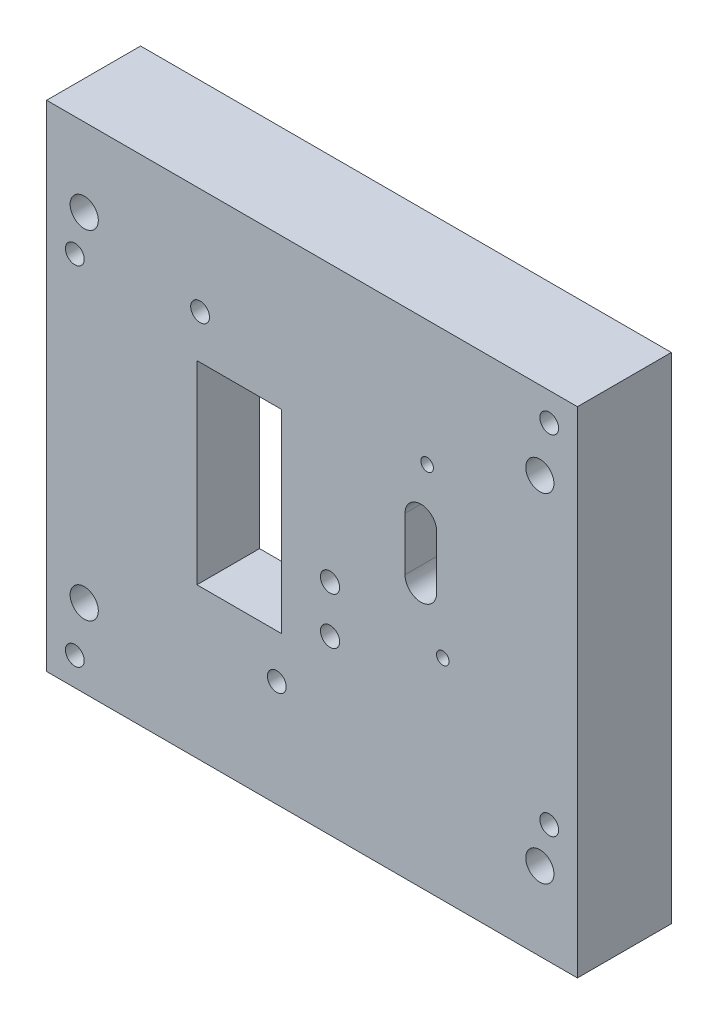
from build123d import *

# Parameters (mm, degrees)
SKETCH2_W                       = 169.5
SKETCH2_H                       = 158
BOSS_EXTRUDE1_DEPTH             = 30
CUT_EXTRUDE2_START              = -10
SKETCH4_R                       = 3.06
SKETCH4_W                       = 27
SKETCH4_H                       = 62
CUT_EXTRUDE2_DEPTH              = 137.360001366
CUT_EXTRUDE4_DEPTH              = 10
SKETCH9_R                       = 2
CUT_EXTRUDE14_DEPTH             = 15
SKETCH11_R                      = 3
CUT_EXTRUDE16_DEPTH             = 7.5
CBORE_FOR_M8_SHCS1_D            = 9
CBORE_FOR_M8_SHCS1_CBORE_D      = 15
CBORE_FOR_M8_SHCS1_CBORE_DEPTH  = 8
M8X1_25_TAPPED_HOLE1_D          = 6.8
M8X1_25_TAPPED_HOLE1_DEPTH      = 12
M8X1_25_TAPPED_HOLE1_TIP        = 2.042926105
M6X1_0_TAPPED_HOLE1_D           = 5
M6X1_0_TAPPED_HOLE1_DEPTH       = 12
M6X1_0_TAPPED_HOLE1_TIP         = 1.502151548
M6X1_0_TAPPED_HOLE2_D           = 5
M6X1_0_TAPPED_HOLE2_DEPTH       = 12
M6X1_0_TAPPED_HOLE2_TIP         = 1.502151548
M6X1_0_TAPPED_HOLE3_D           = 5
M6X1_0_TAPPED_HOLE3_DEPTH       = 12
M6X1_0_TAPPED_HOLE3_CBORE_D     = 6
M6X1_0_TAPPED_HOLE3_CBORE_DEPTH = 6.5
M6X1_0_TAPPED_HOLE3_TIP         = 1.502151548
F_6_0MM_CLEARANCE_DOWEL_HOLE1_D = 6
F_6_0MM_CLEARANCE_DOWEL_HOLE2_D = 6
F_6_0MM_CLEARANCE_DOWEL_HOLE3_D = 6
F_4_0MM_CLEARANCE_DOWEL_HOLE1_D = 4


with BuildPart() as part:
    # Sketch2 → Boss-Extrude1 (new body)
    with BuildSketch(Plane.XY):
        with Locations((-34.75, 0)):
            Rectangle(SKETCH2_W, SKETCH2_H)
    extrude(amount=BOSS_EXTRUDE1_DEPTH)

    # Sketch4 → Cut-Extrude2 (cut, through all)
    with BuildSketch(Plane(origin=(0, 0, 0), x_dir=(-1, 0, 0), z_dir=(0, 0, -1)).offset(CUT_EXTRUDE2_START)):
        with Locations((29, -9)):
            Circle(SKETCH4_R)
        with Locations((29, -24)):
            Circle(SKETCH4_R)
        with BuildLine():
            Line((-5.06, 22), (-5.06, 5))
            ThreePointArc((-5.06, 5), (0, -0.06), (5.06, 5))
            Line((5.06, 5), (5.06, 22))
            ThreePointArc((5.06, 22), (0, 27.06), (-5.06, 22))
        make_face()
        with Locations((58, 0)):
            Rectangle(SKETCH4_W, SKETCH4_H)
    extrude(amount=-CUT_EXTRUDE2_DEPTH, mode=Mode.SUBTRACT)

    # Sketch5 → Cut-Extrude4 (cut)
    with BuildSketch(Plane(origin=(0, 0, 0), x_dir=(-1, 0, 0), z_dir=(0, 0, -1))):
        with BuildLine():
            Line((-25, 45), (-25, -18))
            ThreePointArc((-25, -18), (-24.414213562, -19.414213562), (-23, -20))
            Line((-23, -20), (14, -20))
            ThreePointArc((14, -20), (15.414213562, -19.414213562), (16, -18))
            Line((16, -18), (16, 45))
            ThreePointArc((16, 45), (15.414213562, 46.414213562), (14, 47))
            Line((14, 47), (-23, 47))
            ThreePointArc((-23, 47), (-24.414213562, 46.414213562), (-25, 45))
        make_face()
        with BuildLine():
            Line((24, -54), (92.5, -54))
            ThreePointArc((92.5, -54), (93.914213562, -53.414213562), (94.5, -52))
            Line((94.5, -52), (94.5, 52))
            ThreePointArc((94.5, 52), (93.914213562, 53.414213562), (92.5, 54))
            Line((92.5, 54), (24, 54))
            ThreePointArc((24, 54), (22.585786438, 53.414213562), (22, 52))
            Line((22, 52), (22, -52))
            ThreePointArc((22, -52), (22.585786438, -53.414213562), (24, -54))
        make_face()
    extrude(amount=-CUT_EXTRUDE4_DEPTH, mode=Mode.SUBTRACT)

    # Sketch9 → Cut-Extrude14 (cut)
    with BuildSketch(Plane(origin=(0, 0, 0), x_dir=(-1, 0, 0), z_dir=(0, 0, -1))):
        with Locations((19, 25)):
            Circle(SKETCH9_R)
        with Locations((19, -25)):
            Circle(SKETCH9_R)
    extrude(amount=-CUT_EXTRUDE14_DEPTH, mode=Mode.SUBTRACT)

    # Sketch11 → Cut-Extrude16 (cut)
    with BuildSketch(Plane(origin=(0, 0, 15), x_dir=(-1, 0, 0), z_dir=(0, 0, -1))):
        with Locations((19, 25)):
            Circle(SKETCH11_R)
        with Locations((19, -25)):
            Circle(SKETCH11_R)
    extrude(amount=-CUT_EXTRUDE16_DEPTH, mode=Mode.SUBTRACT)

    # CBORE for M8 SHCS1 (through all)
    with Locations(Plane(origin=(0, 0, 0), x_dir=(-0.9063077870366375, -0.4226182617407263, 0), z_dir=(0, 0, -1))):
        with Locations((74.606700972, 94.372083637), (120.24947324, -3.509157363), (-57.261082041, 32.881126554), (-11.618309773, -65.000114446)):
            CounterBoreHole(CBORE_FOR_M8_SHCS1_D / 2, CBORE_FOR_M8_SHCS1_CBORE_D / 2, CBORE_FOR_M8_SHCS1_CBORE_DEPTH)

    # M8x1.25 Tapped Hole1
    with Locations(Plane(origin=(0, 0, 10), x_dir=(-0.9063077870366375, -0.4226182617407263, 0), z_dir=(0, 0, -1))):
        with Locations((57.020425437, 72.930933649), (13.064497766, 52.433947955), (48.564431752, -23.695906156), (92.520359424, -3.198920462)):
            Hole(M8X1_25_TAPPED_HOLE1_D / 2, depth=M8X1_25_TAPPED_HOLE1_DEPTH)
            with Locations((0, 0, -(M8X1_25_TAPPED_HOLE1_DEPTH + M8X1_25_TAPPED_HOLE1_TIP / 2))):  # 118° drill point
                Cone(0, M8X1_25_TAPPED_HOLE1_D / 2, M8X1_25_TAPPED_HOLE1_TIP, mode=Mode.SUBTRACT)

    # M6x1.0 Tapped Hole1
    with Locations(Plane(origin=(0, 0, 10), x_dir=(-0.9063077870366375, -0.4226182617407263, 0), z_dir=(0, 0, -1))):
        with Locations((-30.560418539, 27.67780372), (10.992955388, -7.011057825), (-9.852123713, -16.731277845), (-9.715339437, 37.39802374)):
            Hole(M6X1_0_TAPPED_HOLE1_D / 2, depth=M6X1_0_TAPPED_HOLE1_DEPTH)
            with Locations((0, 0, -(M6X1_0_TAPPED_HOLE1_DEPTH + M6X1_0_TAPPED_HOLE1_TIP / 2))):  # 118° drill point
                Cone(0, M6X1_0_TAPPED_HOLE1_D / 2, M6X1_0_TAPPED_HOLE1_TIP, mode=Mode.SUBTRACT)

    # M6x1.0 Tapped Hole2
    with Locations(Plane(origin=(0, 0, 0), x_dir=(-0.9063077870366375, -0.4226182617407263, 0), z_dir=(0, 0, -1))):
        with Locations((101.634747391, -29.843393284), (20.520200451, -67.66772771), (8.306532687, -41.475432665)):
            Hole(M6X1_0_TAPPED_HOLE2_D / 2, depth=M6X1_0_TAPPED_HOLE2_DEPTH)
            with Locations((0, 0, -(M6X1_0_TAPPED_HOLE2_DEPTH + M6X1_0_TAPPED_HOLE2_TIP / 2))):  # 118° drill point
                Cone(0, M6X1_0_TAPPED_HOLE2_D / 2, M6X1_0_TAPPED_HOLE2_TIP, mode=Mode.SUBTRACT)

    # M6x1.0 Tapped Hole3
    with Locations(Plane(origin=(0, 0, 0), x_dir=(-0.9063077870366375, -0.4226182617407263, 0), z_dir=(0, 0, -1))):
        with Locations((42.468190748, 97.039696901), (-32.729700528, 46.527053457), (-38.646356192, 59.215362475)):
            CounterBoreHole(M6X1_0_TAPPED_HOLE3_D / 2, M6X1_0_TAPPED_HOLE3_CBORE_D / 2, M6X1_0_TAPPED_HOLE3_CBORE_DEPTH, depth=M6X1_0_TAPPED_HOLE3_DEPTH)
            with Locations((0, 0, -(M6X1_0_TAPPED_HOLE3_DEPTH + M6X1_0_TAPPED_HOLE3_TIP / 2))):  # 118° drill point
                Cone(0, M6X1_0_TAPPED_HOLE3_D / 2, M6X1_0_TAPPED_HOLE3_TIP, mode=Mode.SUBTRACT)

    # Ø6.0mm Clearance Dowel Hole1 (through all)
    with Locations(Plane(origin=(0, 0, 0), x_dir=(-0.9063077870366375, -0.4226182617407263, 0), z_dir=(0, 0, -1))):
        with Locations((-66.74189759, 46.114196361), (82.819661736, 83.857937191)):
            Hole(F_6_0MM_CLEARANCE_DOWEL_HOLE1_D / 2)

    # Ø6.0mm Clearance Dowel Hole2 (through all)
    with Locations(Plane(origin=(0, 0, 0), x_dir=(-0.9063077870366375, -0.4226182617407263, 0), z_dir=(0, 0, -1))):
        with Locations((-19.789008711, -54.576598779), (129.730288789, -16.74222717)):
            Hole(F_6_0MM_CLEARANCE_DOWEL_HOLE2_D / 2)

    # Ø6.0mm Clearance Dowel Hole3 (through all)
    with Locations(Plane(origin=(0, 0, 10), x_dir=(-0.9063077870366375, -0.4226182617407263, 0), z_dir=(0, 0, -1))):
        with Locations((44.876877208, 70.578437869), (60.707979982, -21.343410377)):
            Hole(F_6_0MM_CLEARANCE_DOWEL_HOLE3_D / 2)

    # Ø4.0mm Clearance Dowel Hole1 (through all)
    with Locations(Plane(origin=(0, 0, 10), x_dir=(-0.9063077870366375, -0.4226182617407263, 0), z_dir=(0, 0, -1))):
        with Locations((-18.294727782, 34.500767171), (-1.272735368, -13.834021277)):
            Hole(F_4_0MM_CLEARANCE_DOWEL_HOLE1_D / 2)


solid = part.part
